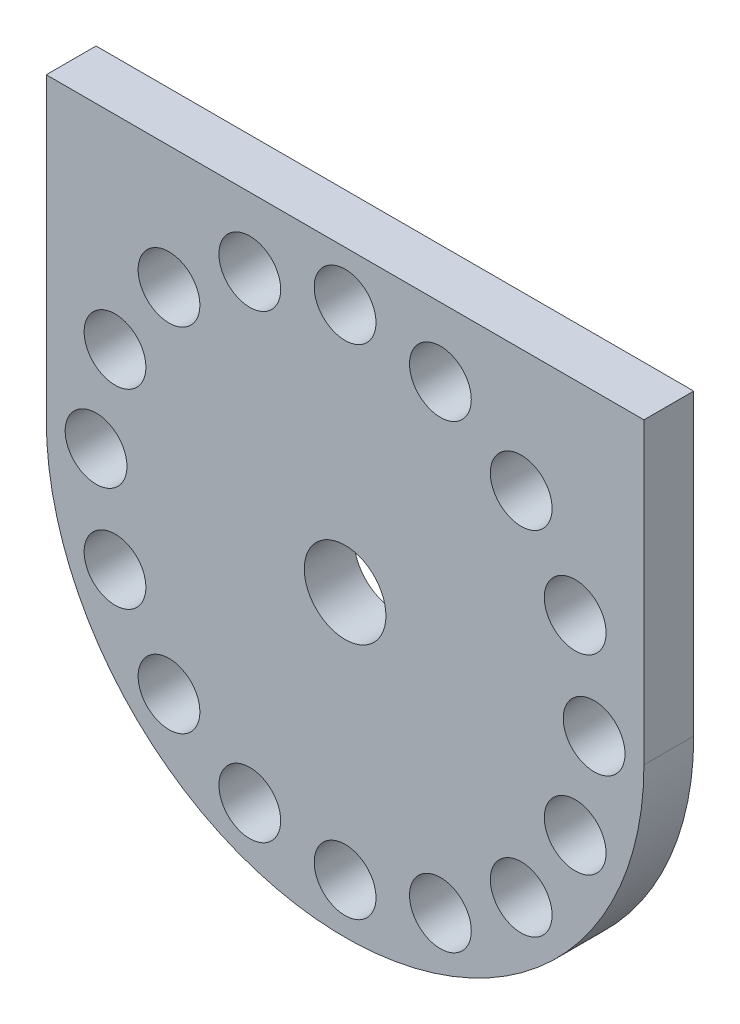
from build123d import *

# Parameters (mm, degrees)
EXTRUDE_1_DEPTH     = 5
SKETCH_3_R          = 4.1
CUT_EXTRUDE_1_DEPTH = 5
SKETCH_5_R          = 3.1
CUT_EXTRUDE_2_DEPTH = 5


with BuildPart() as part:
    # 草图2 → 凸台-拉伸1 (new body)
    with BuildSketch(Plane.XY):
        with BuildLine():
            Line((-30, 30), (30, 30))
            Line((30, 30), (30, 0))
            ThreePointArc((30, 0), (0, -30), (-30, 0))
            Line((-30, 0), (-30, 30))
        make_face()
    extrude(amount=EXTRUDE_1_DEPTH)

    # 草图3 → 切除-拉伸1 (cut)
    with BuildSketch(Plane.XY.offset(5)):
        Circle(SKETCH_3_R)
    extrude(amount=-CUT_EXTRUDE_1_DEPTH, mode=Mode.SUBTRACT)

    # 草图5 → 切除-拉伸2 (cut)
    with BuildSketch(Plane.XY.offset(5)):
        with Locations((0, 25)):
            Circle(SKETCH_5_R)
        with Locations((9.567085809, 23.096988313)):
            Circle(SKETCH_5_R)
        with Locations((17.67766953, 17.67766953)):
            Circle(SKETCH_5_R)
        with Locations((23.096988313, 9.567085809)):
            Circle(SKETCH_5_R)
        with Locations((25, 0)):
            Circle(SKETCH_5_R)
        with Locations((23.096988313, -9.567085809)):
            Circle(SKETCH_5_R)
        with Locations((17.67766953, -17.67766953)):
            Circle(SKETCH_5_R)
        with Locations((9.567085809, -23.096988313)):
            Circle(SKETCH_5_R)
        with Locations((0, -25)):
            Circle(SKETCH_5_R)
        with Locations((-9.567085809, -23.096988313)):
            Circle(SKETCH_5_R)
        with Locations((-17.67766953, -17.67766953)):
            Circle(SKETCH_5_R)
        with Locations((-23.096988313, -9.567085809)):
            Circle(SKETCH_5_R)
        with Locations((-25, 0)):
            Circle(SKETCH_5_R)
        with Locations((-23.096988313, 9.567085809)):
            Circle(SKETCH_5_R)
        with Locations((-17.67766953, 17.67766953)):
            Circle(SKETCH_5_R)
        with Locations((-9.567085809, 23.096988313)):
            Circle(SKETCH_5_R)
    extrude(amount=-CUT_EXTRUDE_2_DEPTH, mode=Mode.SUBTRACT)


solid = part.part
